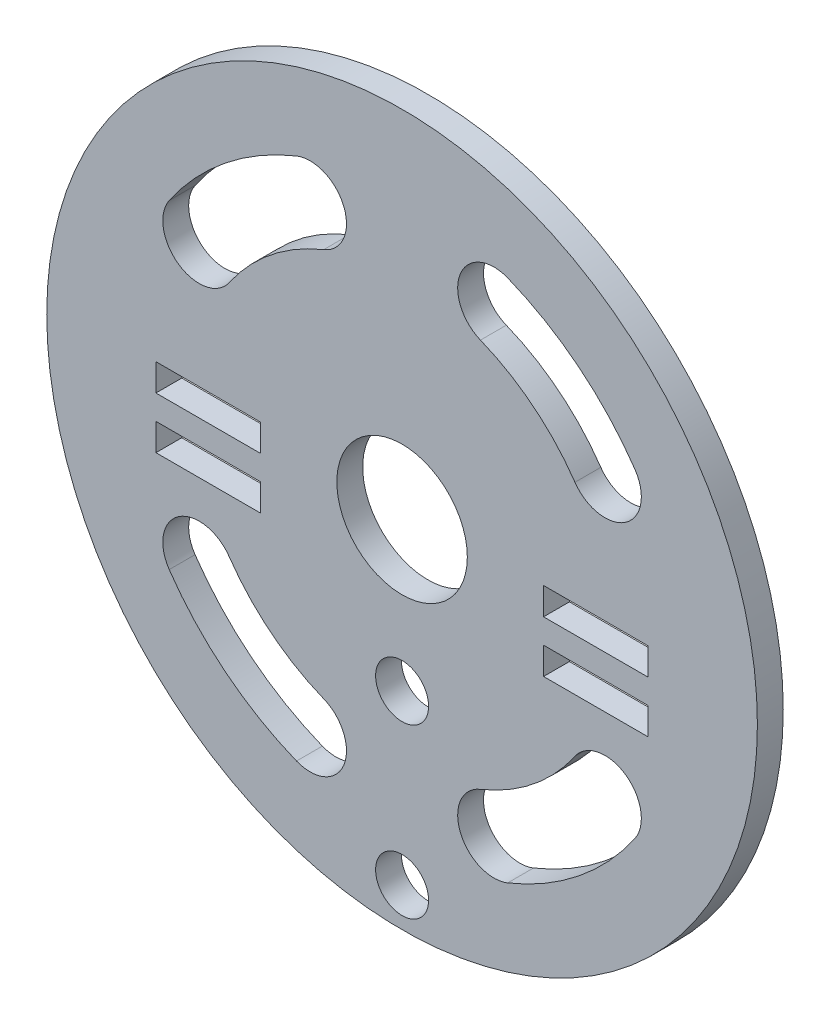
from build123d import *

# Parameters (mm, degrees)
SKETCH_1_R      = 27.5
SKETCH_1_R_2    = 5.05
SKETCH_1_R_3    = 2.05
SKETCH_1_W      = 8.1
SKETCH_1_H      = 2.1
EXTRUDE_1_DEPTH = 2


with BuildPart() as part:
    # 草图1 → 凸台-拉伸1 (new body)
    with BuildSketch(Plane.XY):
        with Locations((0, 4)):
            Circle(SKETCH_1_R)
        with Locations((0, 4)):
            Circle(SKETCH_1_R_2, mode=Mode.SUBTRACT)
        with Locations((0, -7.5)):
            Circle(SKETCH_1_R_3, mode=Mode.SUBTRACT)
        with Locations((0, -20.5)):
            Circle(SKETCH_1_R_3, mode=Mode.SUBTRACT)
        with Locations((-15, 4)):
            Rectangle(SKETCH_1_W, SKETCH_1_H, mode=Mode.SUBTRACT)
        with Locations((-15, 0)):
            Rectangle(SKETCH_1_W, SKETCH_1_H, mode=Mode.SUBTRACT)
        with Locations((15, 4)):
            Rectangle(SKETCH_1_W, SKETCH_1_H, mode=Mode.SUBTRACT)
        with Locations((15, 0)):
            Rectangle(SKETCH_1_W, SKETCH_1_H, mode=Mode.SUBTRACT)
        with BuildLine():
            ThreePointArc((-18.02272766, -8.370387974), (-13.679746228, -13.050212729), (-8.169823727, -16.275581156))
            ThreePointArc((-8.169823727, -16.275581156), (-4.506388665, -14.716501354), (-6.065468468, -11.053066292))
            ThreePointArc((-6.065468468, -11.053066292), (-10.156163971, -8.658477236), (-13.380495097, -5.184065739))
            ThreePointArc((-13.380495097, -5.184065739), (-17.294772496, -4.456110575), (-18.02272766, -8.370387974))
        make_face(mode=Mode.SUBTRACT)
        with BuildLine():
            ThreePointArc((18.02272766, -8.370387974), (13.679746228, -13.050212729), (8.169823727, -16.275581156))
            ThreePointArc((8.169823727, -16.275581156), (4.506388665, -14.716501354), (6.065468468, -11.053066292))
            ThreePointArc((6.065468468, -11.053066292), (10.156163971, -8.658477236), (13.380495097, -5.184065739))
            ThreePointArc((13.380495097, -5.184065739), (17.294772496, -4.456110575), (18.02272766, -8.370387974))
        make_face(mode=Mode.SUBTRACT)
        with BuildLine():
            ThreePointArc((18.02272766, 16.370387974), (13.679746228, 21.050212729), (8.169823727, 24.275581156))
            ThreePointArc((8.169823727, 24.275581156), (4.506388665, 22.716501354), (6.065468468, 19.053066292))
            ThreePointArc((6.065468468, 19.053066292), (10.156163971, 16.658477236), (13.380495097, 13.184065739))
            ThreePointArc((13.380495097, 13.184065739), (17.294772496, 12.456110575), (18.02272766, 16.370387974))
        make_face(mode=Mode.SUBTRACT)
        with BuildLine():
            ThreePointArc((-18.02272766, 16.370387974), (-13.679746228, 21.050212729), (-8.169823727, 24.275581156))
            ThreePointArc((-8.169823727, 24.275581156), (-4.506388665, 22.716501354), (-6.065468468, 19.053066292))
            ThreePointArc((-6.065468468, 19.053066292), (-10.156163971, 16.658477236), (-13.380495097, 13.184065739))
            ThreePointArc((-13.380495097, 13.184065739), (-17.294772496, 12.456110575), (-18.02272766, 16.370387974))
        make_face(mode=Mode.SUBTRACT)
    extrude(amount=EXTRUDE_1_DEPTH)


solid = part.part
